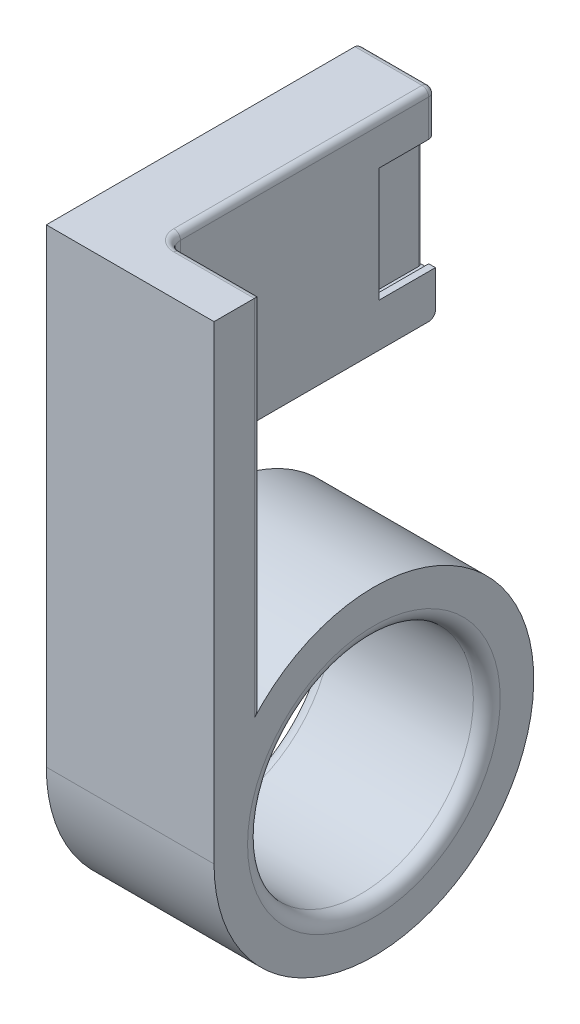
from build123d import *

# Parameters (mm, degrees)
SKETCH1_R           = 23.8275
SKETCH1_R_2         = 16.8275
BOSS_EXTRUDE1_DEPTH = 25
SKETCH2_W           = 25
SKETCH2_H           = 7
BOSS_EXTRUDE2_DEPTH = 70
SKETCH3_W           = 11
SKETCH3_H           = 30
BOSS_EXTRUDE3_DEPTH = 40
SKETCH4_W           = 8.4
SKETCH4_H           = 8.525
CUT_EXTRUDE1_DEPTH  = 1
SKETCH5_W           = 9
SKETCH5_H           = 18.25
CUT_EXTRUDE2_DEPTH  = 1
FILLET1_R           = 0.5
FILLET2_R           = 1
FILLET3_R           = 2
FILLET4_R           = 2
FILLET6_R           = 1


with BuildPart() as part:
    # Sketch1 → Boss-Extrude1 (new body)
    with BuildSketch(Plane(origin=(0, 0, 0), x_dir=(0, 0, -1), z_dir=(1, 0, 0))):
        Circle(SKETCH1_R)
        Circle(SKETCH1_R_2, mode=Mode.SUBTRACT)
    extrude(amount=BOSS_EXTRUDE1_DEPTH)

    # Sketch2 → Boss-Extrude2 (add)
    with BuildSketch(Plane(origin=(0, 0, 0), x_dir=(1, 0, 0), z_dir=(0, 1, 0))):
        with Locations((12.5, -20.3275)):
            Rectangle(SKETCH2_W, SKETCH2_H)
    extrude(amount=BOSS_EXTRUDE2_DEPTH)

    # Sketch3 → Boss-Extrude3 (add)
    with BuildSketch(Plane(origin=(0, 0, 16.8275), x_dir=(-1, 0, 0), z_dir=(0, 0, -1))):
        with Locations((-5.5, 55)):
            Rectangle(SKETCH3_W, SKETCH3_H)
    extrude(amount=BOSS_EXTRUDE3_DEPTH)

    # Sketch4 → Cut-Extrude1 (cut)
    with BuildSketch(Plane(origin=(11, 0, 0), x_dir=(0, 0, -1), z_dir=(1, 0, 0))):
        with Locations((18.9725, 50.7375)):
            Rectangle(SKETCH4_W, SKETCH4_H)
        with Locations((18.9725, 59.2625)):
            Rectangle(SKETCH4_W, SKETCH4_H)
    extrude(amount=-CUT_EXTRUDE1_DEPTH, mode=Mode.SUBTRACT)

    # Sketch5 → Cut-Extrude2 (cut)
    with BuildSketch(Plane(origin=(10, 0, 0), x_dir=(0, 0, -1), z_dir=(1, 0, 0))):
        with Locations((18.6725, 55)):
            Rectangle(SKETCH5_W, SKETCH5_H)
    extrude(amount=-CUT_EXTRUDE2_DEPTH, mode=Mode.SUBTRACT)

    # Fillet1
    fillet1_edges = [part.edges().sort_by_distance(p)[0] for p in [
        (9, 55, -23.1725),
    ]]
    fillet(fillet1_edges, radius=FILLET1_R)

    # Fillet2
    fillet2_edges = [part.edges().sort_by_distance(p)[0] for p in [
        (0, 55, -23.1725),
        (5.5, 70, -23.1725),
        (5.5, 40, -23.1725),
    ]]
    fillet(fillet2_edges, radius=FILLET2_R)

    # Fillet3
    fillet3_edges = [part.edges().sort_by_distance(p)[0] for p in [
        (0, 0, 16.8275),
        (25, 0, 16.8275),
    ]]
    fillet(fillet3_edges, radius=FILLET3_R)

    # Fillet4
    fillet4_edges = [part.edges().sort_by_distance(p)[0] for p in [
        (11, 55, 16.8275),
    ]]
    fillet(fillet4_edges, radius=FILLET4_R)

    # Fillet6
    fillet6_edges = [part.edges().sort_by_distance(p)[0] for p in [
        (11.585786438, 70, 16.241713562),
        (25, 43.43482365, 16.8275),
        (19, 70, 16.8275),
        (11, 66.2625, -23.1725),
        (11, 70, -3.6725),
        (11, 69.707106781, -22.879606781),
    ]]
    fillet(fillet6_edges, radius=FILLET6_R)


solid = part.part
